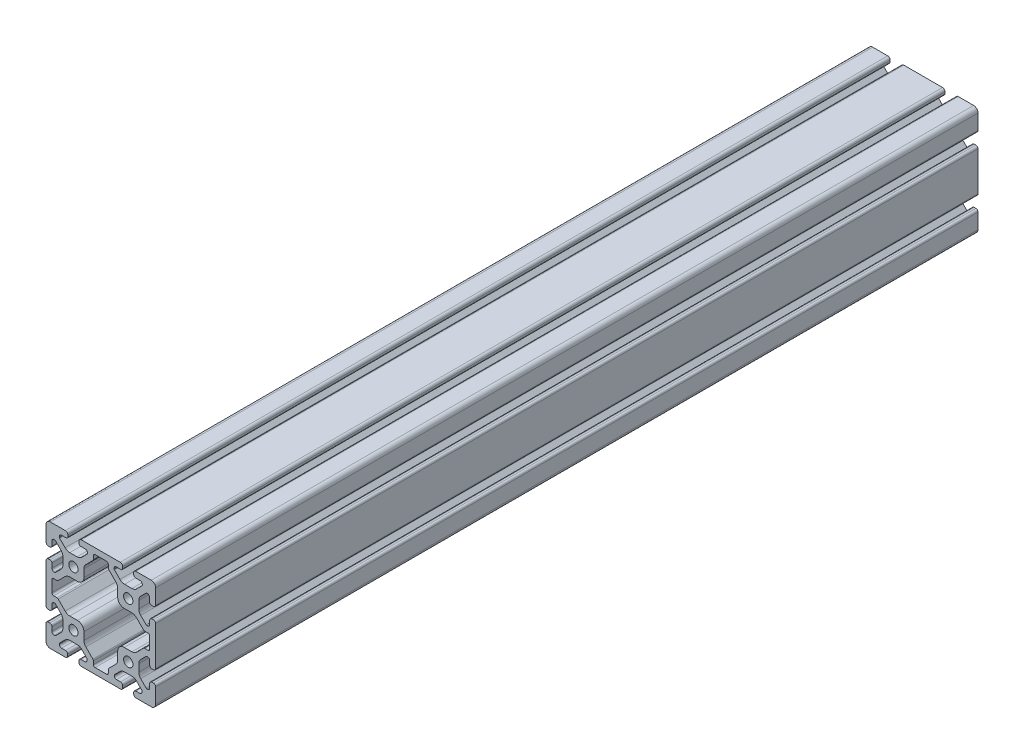
from build123d import *

# Parameters (mm, degrees)
SKETCH1_R      = 3.4
EXTRUDE1_DEPTH = 600


with BuildPart() as part:
    # Sketch1 → Extrude1 (new body)
    with BuildSketch(Plane.XY):
        with BuildLine():
            Line((29.091242789, 26.036541495), (33.082657296, 30.027956002))
            ThreePointArc((33.082657296, 30.027956002), (33.329219041, 30.192703293), (33.62005845, 30.250554848))
            Line((33.62005845, 30.250554848), (33.955571436, 30.250554848))
            ThreePointArc((33.955571436, 30.250554848), (35.065729082, 29.790712494), (35.525571436, 28.680554848))
            Line((35.525571436, 28.680554848), (35.525571436, 25.777866899))
            ThreePointArc((35.525571436, 25.777866899), (35.985413789, 24.667709253), (37.095571436, 24.207866899))
            Line((37.095571436, 24.207866899), (38.43, 24.207866899))
            ThreePointArc((38.43, 24.207866899), (39.540157646, 24.667709253), (40, 25.777866899))
            Line((40, 25.777866899), (40, 32.933852749))
            Line((40, 32.933852749), (40, 36.83))
            ThreePointArc((40, 36.83), (39.071528496, 39.071528496), (36.83, 40))
            Line((36.83, 40), (25.540851266, 40))
            ThreePointArc((25.540851266, 40), (24.43069362, 39.540157646), (23.970851266, 38.43))
            Line((23.970851266, 38.43), (23.970851266, 37.249043598))
            ThreePointArc((23.970851266, 37.249043598), (24.43069362, 36.138885952), (25.540851266, 35.679043598))
            Line((25.540851266, 35.679043598), (28.625762638, 35.679043598))
            ThreePointArc((28.625762638, 35.679043598), (29.77116849, 35.239363487), (30.250554848, 34.11))
            Line((30.250554848, 34.11), (30.250554848, 33.62005845))
            ThreePointArc((30.250554848, 33.62005845), (30.192703293, 33.329219041), (30.027956002, 33.082657296))
            Line((30.027956002, 33.082657296), (26.036541495, 29.091242789))
            ThreePointArc((26.036541495, 29.091242789), (24.495530588, 28.061572221), (22.677784284, 27.7))
            Line((22.677784284, 27.7), (17.322215716, 27.7))
            ThreePointArc((17.322215716, 27.7), (15.504469412, 28.061572221), (13.963458505, 29.091242789))
            Line((13.963458505, 29.091242789), (9.90393336, 33.150767934))
            ThreePointArc((9.90393336, 33.150767934), (9.764102181, 33.360040084), (9.715, 33.606893415))
            Line((9.715, 33.606893415), (9.715, 34.096834965))
            ThreePointArc((9.715, 34.096834965), (10.178698303, 35.216301697), (11.298165035, 35.68))
            Line((11.298165035, 35.68), (14.642754087, 35.68))
            ThreePointArc((14.642754087, 35.68), (15.560045469, 36.059954531), (15.94, 36.977245913))
            Line((15.94, 36.977245913), (15.94, 38.194841282))
            ThreePointArc((15.94, 38.194841282), (15.411281253, 39.471281253), (14.134841282, 40))
            Line((14.134841282, 40), (6.984433948, 40))
            Line((6.984433948, 40), (-6.984433948, 40))
            Line((-6.984433948, 40), (-14.134841282, 40))
            ThreePointArc((-14.134841282, 40), (-15.411281253, 39.471281253), (-15.94, 38.194841282))
            Line((-15.94, 38.194841282), (-15.94, 36.977245913))
            ThreePointArc((-15.94, 36.977245913), (-15.560045469, 36.059954531), (-14.642754087, 35.68))
            Line((-14.642754087, 35.68), (-11.298165035, 35.68))
            ThreePointArc((-11.298165035, 35.68), (-10.178698303, 35.216301697), (-9.715, 34.096834965))
            Line((-9.715, 34.096834965), (-9.715, 33.606893415))
            ThreePointArc((-9.715, 33.606893415), (-9.764102181, 33.360040084), (-9.90393336, 33.150767934))
            Line((-9.90393336, 33.150767934), (-13.963458505, 29.091242789))
            ThreePointArc((-13.963458505, 29.091242789), (-15.504469412, 28.061572221), (-17.322215716, 27.7))
            Line((-17.322215716, 27.7), (-22.677784284, 27.7))
            ThreePointArc((-22.677784284, 27.7), (-24.495530588, 28.061572221), (-26.036541495, 29.091242789))
            Line((-26.036541495, 29.091242789), (-30.09606664, 33.150767934))
            ThreePointArc((-30.09606664, 33.150767934), (-30.235897819, 33.360040084), (-30.285, 33.606893415))
            Line((-30.285, 33.606893415), (-30.285, 34.096834965))
            ThreePointArc((-30.285, 34.096834965), (-29.821301697, 35.216301697), (-28.701834965, 35.68))
            Line((-28.701834965, 35.68), (-25.357245913, 35.68))
            ThreePointArc((-25.357245913, 35.68), (-24.439954531, 36.059954531), (-24.06, 36.977245913))
            Line((-24.06, 36.977245913), (-24.06, 38.194841282))
            ThreePointArc((-24.06, 38.194841282), (-24.588718747, 39.471281253), (-25.865158718, 40))
            Line((-25.865158718, 40), (-33.031395847, 40))
            Line((-33.031395847, 40), (-36.83, 40))
            ThreePointArc((-36.83, 40), (-39.071528496, 39.071528496), (-40, 36.83))
            Line((-40, 36.83), (-40, 33.318079463))
            Line((-40, 33.318079463), (-40, 25.865158718))
            ThreePointArc((-40, 25.865158718), (-39.471281253, 24.588718747), (-38.194841282, 24.06))
            Line((-38.194841282, 24.06), (-36.977245913, 24.06))
            ThreePointArc((-36.977245913, 24.06), (-36.059954531, 24.439954531), (-35.68, 25.357245913))
            Line((-35.68, 25.357245913), (-35.68, 28.680554848))
            ThreePointArc((-35.68, 28.680554848), (-35.220157646, 29.790712494), (-34.11, 30.250554848))
            Line((-34.11, 30.250554848), (-33.62005845, 30.250554848))
            ThreePointArc((-33.62005845, 30.250554848), (-33.329219041, 30.192703293), (-33.082657296, 30.027956002))
            Line((-33.082657296, 30.027956002), (-29.091242789, 26.036541495))
            ThreePointArc((-29.091242789, 26.036541495), (-28.061572221, 24.495530588), (-27.7, 22.677784284))
            Line((-27.7, 22.677784284), (-27.7, 17.322215716))
            ThreePointArc((-27.7, 17.322215716), (-28.061572221, 15.504469412), (-29.091242789, 13.963458505))
            Line((-29.091242789, 13.963458505), (-33.082657296, 9.972043998))
            ThreePointArc((-33.082657296, 9.972043998), (-33.329219041, 9.807296707), (-33.62005845, 9.749445152))
            Line((-33.62005845, 9.749445152), (-34.11, 9.749445152))
            ThreePointArc((-34.11, 9.749445152), (-35.220157646, 10.209287506), (-35.68, 11.319445152))
            Line((-35.68, 11.319445152), (-35.68, 14.642754087))
            ThreePointArc((-35.68, 14.642754087), (-36.059954531, 15.560045469), (-36.977245913, 15.94))
            Line((-36.977245913, 15.94), (-38.194841282, 15.94))
            ThreePointArc((-38.194841282, 15.94), (-39.471281253, 15.411281253), (-40, 14.134841282))
            Line((-40, 14.134841282), (-40, 7.016888977))
            Line((-40, 7.016888977), (-40, -7.016888977))
            Line((-40, -7.016888977), (-40, -14.447338303))
            ThreePointArc((-40, -14.447338303), (-39.540157646, -15.557495949), (-38.43, -16.017338303))
            Line((-38.43, -16.017338303), (-37.25, -16.017338303))
            ThreePointArc((-37.25, -16.017338303), (-36.139842354, -15.557495949), (-35.68, -14.447338303))
            Line((-35.68, -14.447338303), (-35.68, -11.319445152))
            ThreePointArc((-35.68, -11.319445152), (-35.220157646, -10.209287506), (-34.11, -9.749445152))
            Line((-34.11, -9.749445152), (-33.62005845, -9.749445152))
            ThreePointArc((-33.62005845, -9.749445152), (-33.329219041, -9.807296707), (-33.082657296, -9.972043998))
            Line((-33.082657296, -9.972043998), (-29.091242789, -13.963458505))
            ThreePointArc((-29.091242789, -13.963458505), (-28.061572221, -15.504469412), (-27.7, -17.322215716))
            Line((-27.7, -17.322215716), (-27.7, -22.677784284))
            ThreePointArc((-27.7, -22.677784284), (-28.061572221, -24.495530588), (-29.091242789, -26.036541495))
            Line((-29.091242789, -26.036541495), (-32.871776968, -29.817075674))
            ThreePointArc((-32.871776968, -29.817075674), (-33.10612883, -29.976640176), (-33.382654504, -30.039211548))
            Line((-33.382654504, -30.039211548), (-34.05520779, -30.062697627))
            ThreePointArc((-34.05520779, -30.062697627), (-35.200613642, -29.623017515), (-35.68, -28.493654028))
            Line((-35.68, -28.493654028), (-35.68, -25.59096608))
            ThreePointArc((-35.68, -25.59096608), (-36.139842354, -24.480808433), (-37.25, -24.02096608))
            Line((-37.25, -24.02096608), (-38.43, -24.02096608))
            ThreePointArc((-38.43, -24.02096608), (-39.540157646, -24.480808433), (-40, -25.59096608))
            Line((-40, -25.59096608), (-40, -33.019082273))
            Line((-40, -33.019082273), (-40, -36.83))
            ThreePointArc((-40, -36.83), (-39.071528496, -39.071528496), (-36.83, -40))
            Line((-36.83, -40), (-33, -40))
            Line((-33, -40), (-25.72307469, -40))
            ThreePointArc((-25.72307469, -40), (-24.612917043, -39.540157646), (-24.15307469, -38.43))
            Line((-24.15307469, -38.43), (-24.15307469, -37.25))
            ThreePointArc((-24.15307469, -37.25), (-24.612917043, -36.139842354), (-25.72307469, -35.68))
            Line((-25.72307469, -35.68), (-28.680554848, -35.68))
            ThreePointArc((-28.680554848, -35.68), (-29.790712494, -35.220157646), (-30.250554848, -34.11))
            Line((-30.250554848, -34.11), (-30.250554848, -33.62005845))
            ThreePointArc((-30.250554848, -33.62005845), (-30.192703293, -33.329219041), (-30.027956002, -33.082657296))
            Line((-30.027956002, -33.082657296), (-26.036541495, -29.091242789))
            ThreePointArc((-26.036541495, -29.091242789), (-24.495530588, -28.061572221), (-22.677784284, -27.7))
            Line((-22.677784284, -27.7), (-17.322215716, -27.7))
            ThreePointArc((-17.322215716, -27.7), (-15.504469412, -28.061572221), (-13.963458505, -29.091242789))
            Line((-13.963458505, -29.091242789), (-10.203784275, -32.85091702))
            ThreePointArc((-10.203784275, -32.85091702), (-10.044219772, -33.085268882), (-9.9816484, -33.361794556))
            Line((-9.9816484, -33.361794556), (-9.957433876, -34.05520779))
            ThreePointArc((-9.957433876, -34.05520779), (-10.397113988, -35.200613642), (-11.526477474, -35.68))
            Line((-11.526477474, -35.68), (-14.429165423, -35.68))
            ThreePointArc((-14.429165423, -35.68), (-15.539323069, -36.139842354), (-15.999165423, -37.25))
            Line((-15.999165423, -37.25), (-15.999165423, -38.43))
            ThreePointArc((-15.999165423, -38.43), (-15.539323069, -39.540157646), (-14.429165423, -40))
            Line((-14.429165423, -40), (-6.998716097, -40))
            Line((-6.998716097, -40), (6.998716097, -40))
            Line((6.998716097, -40), (14.424638994, -40))
            ThreePointArc((14.424638994, -40), (15.53479664, -39.540157646), (15.994638994, -38.43))
            Line((15.994638994, -38.43), (15.994638994, -37.032644306))
            ThreePointArc((15.994638994, -37.032644306), (15.53479664, -35.922486659), (14.424638994, -35.462644306))
            Line((14.424638994, -35.462644306), (11.382372282, -35.462644306))
            ThreePointArc((11.382372282, -35.462644306), (10.272214636, -35.002801952), (9.812372282, -33.892644306))
            Line((9.812372282, -33.892644306), (9.812372282, -33.55713132))
            ThreePointArc((9.812372282, -33.55713132), (9.870223837, -33.266291912), (10.034971128, -33.019730166))
            Line((10.034971128, -33.019730166), (13.963458505, -29.091242789))
            ThreePointArc((13.963458505, -29.091242789), (15.504469412, -28.061572221), (17.322215716, -27.7))
            Line((17.322215716, -27.7), (22.677784284, -27.7))
            ThreePointArc((22.677784284, -27.7), (24.495530588, -28.061572221), (26.036541495, -29.091242789))
            Line((26.036541495, -29.091242789), (29.794925243, -32.849626538))
            ThreePointArc((29.794925243, -32.849626538), (29.954489746, -33.083978399), (30.017061118, -33.360504074))
            Line((30.017061118, -33.360504074), (30.041320706, -34.05520779))
            ThreePointArc((30.041320706, -34.05520779), (29.601640594, -35.200613642), (28.472277108, -35.68))
            Line((28.472277108, -35.68), (25.569589159, -35.68))
            ThreePointArc((25.569589159, -35.68), (24.459431513, -36.139842354), (23.999589159, -37.25))
            Line((23.999589159, -37.25), (23.999589159, -38.43))
            ThreePointArc((23.999589159, -38.43), (24.459431513, -39.540157646), (25.569589159, -40))
            Line((25.569589159, -40), (32.999849358, -40))
            Line((32.999849358, -40), (36.83, -40))
            ThreePointArc((36.83, -40), (39.071528496, -39.071528496), (40, -36.83))
            Line((40, -36.83), (40, -33.025941835))
            Line((40, -33.025941835), (40, -25.777866899))
            ThreePointArc((40, -25.777866899), (39.540157646, -24.667709253), (38.43, -24.207866899))
            Line((38.43, -24.207866899), (37.25, -24.207866899))
            ThreePointArc((37.25, -24.207866899), (36.139842354, -24.667709253), (35.68, -25.777866899))
            Line((35.68, -25.777866899), (35.68, -28.680554848))
            ThreePointArc((35.68, -28.680554848), (35.220157646, -29.790712494), (34.11, -30.250554848))
            Line((34.11, -30.250554848), (33.62005845, -30.250554848))
            ThreePointArc((33.62005845, -30.250554848), (33.329219041, -30.192703293), (33.082657296, -30.027956002))
            Line((33.082657296, -30.027956002), (29.091242789, -26.036541495))
            ThreePointArc((29.091242789, -26.036541495), (28.061572221, -24.495530588), (27.7, -22.677784284))
            Line((27.7, -22.677784284), (27.7, -17.322215716))
            ThreePointArc((27.7, -17.322215716), (28.061572221, -15.504469412), (29.091242789, -13.963458505))
            Line((29.091242789, -13.963458505), (33.082657296, -9.972043998))
            ThreePointArc((33.082657296, -9.972043998), (33.329219041, -9.807296707), (33.62005845, -9.749445152))
            Line((33.62005845, -9.749445152), (34.11, -9.749445152))
            ThreePointArc((34.11, -9.749445152), (35.220157646, -10.209287506), (35.68, -11.319445152))
            Line((35.68, -11.319445152), (35.68, -14.222133101))
            ThreePointArc((35.68, -14.222133101), (36.139842354, -15.332290747), (37.25, -15.792133101))
            Line((37.25, -15.792133101), (38.43, -15.792133101))
            ThreePointArc((38.43, -15.792133101), (39.540157646, -15.332290747), (40, -14.222133101))
            Line((40, -14.222133101), (40, -7.021415406))
            Line((40, -7.021415406), (40, 7.021415406))
            Line((40, 7.021415406), (40, 14.222133101))
            ThreePointArc((40, 14.222133101), (39.540157646, 15.332290747), (38.43, 15.792133101))
            Line((38.43, 15.792133101), (37.25, 15.792133101))
            ThreePointArc((37.25, 15.792133101), (36.139842354, 15.332290747), (35.68, 14.222133101))
            Line((35.68, 14.222133101), (35.68, 11.319445152))
            ThreePointArc((35.68, 11.319445152), (35.220157646, 10.209287506), (34.11, 9.749445152))
            Line((34.11, 9.749445152), (33.62005845, 9.749445152))
            ThreePointArc((33.62005845, 9.749445152), (33.329219041, 9.807296707), (33.082657296, 9.972043998))
            Line((33.082657296, 9.972043998), (29.091242789, 13.963458505))
            ThreePointArc((29.091242789, 13.963458505), (28.061572221, 15.504469412), (27.7, 17.322215716))
            Line((27.7, 17.322215716), (27.7, 22.677784284))
            ThreePointArc((27.7, 22.677784284), (28.061572221, 24.495530588), (29.091242789, 26.036541495))
        make_face()
        with Locations((-20, 20)):
            Circle(SKETCH1_R, mode=Mode.SUBTRACT)
        with Locations((20, 20)):
            Circle(SKETCH1_R, mode=Mode.SUBTRACT)
        with Locations((20, -20)):
            Circle(SKETCH1_R, mode=Mode.SUBTRACT)
        with Locations((-20, -20)):
            Circle(SKETCH1_R, mode=Mode.SUBTRACT)
        with BuildLine():
            Line((17.07, 12.32), (22.657784284, 12.32))
            ThreePointArc((22.657784284, 12.32), (24.475530588, 11.958427779), (26.016541495, 10.928757211))
            Line((26.016541495, 10.928757211), (31.143879165, 5.80141954))
            ThreePointArc((31.143879165, 5.80141954), (31.555896818, 5.526118146), (32.041904777, 5.429445152))
            Line((32.041904777, 5.429445152), (34.41, 5.429445152))
            ThreePointArc((34.41, 5.429445152), (35.308025612, 5.057470764), (35.68, 4.159445152))
            Line((35.68, 4.159445152), (35.68, -4.159445152))
            ThreePointArc((35.68, -4.159445152), (35.308025612, -5.057470764), (34.41, -5.429445152))
            Line((34.41, -5.429445152), (32.041904777, -5.429445152))
            ThreePointArc((32.041904777, -5.429445152), (31.555896818, -5.526118146), (31.143879165, -5.80141954))
            Line((31.143879165, -5.80141954), (26.016541495, -10.928757211))
            ThreePointArc((26.016541495, -10.928757211), (24.475530588, -11.958427779), (22.657784284, -12.32))
            Line((22.657784284, -12.32), (17.07, -12.32))
            ThreePointArc((17.07, -12.32), (13.711242789, -13.711242789), (12.32, -17.07))
            Line((12.32, -17.07), (12.32, -22.657784284))
            ThreePointArc((12.32, -22.657784284), (11.958427779, -24.475530588), (10.928757211, -26.016541495))
            Line((10.928757211, -26.016541495), (5.80141954, -31.143879165))
            ThreePointArc((5.80141954, -31.143879165), (5.526118146, -31.555896818), (5.429445152, -32.041904777))
            Line((5.429445152, -32.041904777), (5.429445152, -34.41))
            ThreePointArc((5.429445152, -34.41), (5.057470764, -35.308025612), (4.159445152, -35.68))
            Line((4.159445152, -35.68), (-4.159445152, -35.68))
            ThreePointArc((-4.159445152, -35.68), (-5.057470764, -35.308025612), (-5.429445152, -34.41))
            Line((-5.429445152, -34.41), (-5.429445152, -32.041904777))
            ThreePointArc((-5.429445152, -32.041904777), (-5.526118146, -31.555896818), (-5.80141954, -31.143879165))
            Line((-5.80141954, -31.143879165), (-10.928757211, -26.016541495))
            ThreePointArc((-10.928757211, -26.016541495), (-11.958427779, -24.475530588), (-12.32, -22.657784284))
            Line((-12.32, -22.657784284), (-12.32, -17.07))
            ThreePointArc((-12.32, -17.07), (-13.711242789, -13.711242789), (-17.07, -12.32))
            Line((-17.07, -12.32), (-22.657784284, -12.32))
            ThreePointArc((-22.657784284, -12.32), (-24.475530588, -11.958427779), (-26.016541495, -10.928757211))
            Line((-26.016541495, -10.928757211), (-31.143879165, -5.80141954))
            ThreePointArc((-31.143879165, -5.80141954), (-31.555896818, -5.526118146), (-32.041904777, -5.429445152))
            Line((-32.041904777, -5.429445152), (-34.41, -5.429445152))
            ThreePointArc((-34.41, -5.429445152), (-35.308025612, -5.057470764), (-35.68, -4.159445152))
            Line((-35.68, -4.159445152), (-35.68, 4.159445152))
            ThreePointArc((-35.68, 4.159445152), (-35.308025612, 5.057470764), (-34.41, 5.429445152))
            Line((-34.41, 5.429445152), (-32.041904777, 5.429445152))
            ThreePointArc((-32.041904777, 5.429445152), (-31.555896818, 5.526118146), (-31.143879165, 5.80141954))
            Line((-31.143879165, 5.80141954), (-26.016541495, 10.928757211))
            ThreePointArc((-26.016541495, 10.928757211), (-24.475530588, 11.958427779), (-22.657784284, 12.32))
            Line((-22.657784284, 12.32), (-17.07, 12.32))
            ThreePointArc((-17.07, 12.32), (-13.711242789, 13.711242789), (-12.32, 17.07))
            Line((-12.32, 17.07), (-12.32, 22.657784284))
            ThreePointArc((-12.32, 22.657784284), (-11.958427779, 24.475530588), (-10.928757211, 26.016541495))
            Line((-10.928757211, 26.016541495), (-5.80141954, 31.143879165))
            ThreePointArc((-5.80141954, 31.143879165), (-5.526118146, 31.555896818), (-5.429445152, 32.041904777))
            Line((-5.429445152, 32.041904777), (-5.429445152, 34.41))
            ThreePointArc((-5.429445152, 34.41), (-5.057470764, 35.308025612), (-4.159445152, 35.68))
            Line((-4.159445152, 35.68), (4.159445152, 35.68))
            ThreePointArc((4.159445152, 35.68), (5.057470764, 35.308025612), (5.429445152, 34.41))
            Line((5.429445152, 34.41), (5.429445152, 32.041904777))
            ThreePointArc((5.429445152, 32.041904777), (5.526118146, 31.555896818), (5.80141954, 31.143879165))
            Line((5.80141954, 31.143879165), (10.928757211, 26.016541495))
            ThreePointArc((10.928757211, 26.016541495), (11.958427779, 24.475530588), (12.32, 22.657784284))
            Line((12.32, 22.657784284), (12.32, 17.07))
            ThreePointArc((12.32, 17.07), (13.711242789, 13.711242789), (17.07, 12.32))
        make_face(mode=Mode.SUBTRACT)
    extrude(amount=-EXTRUDE1_DEPTH)


solid = part.part
